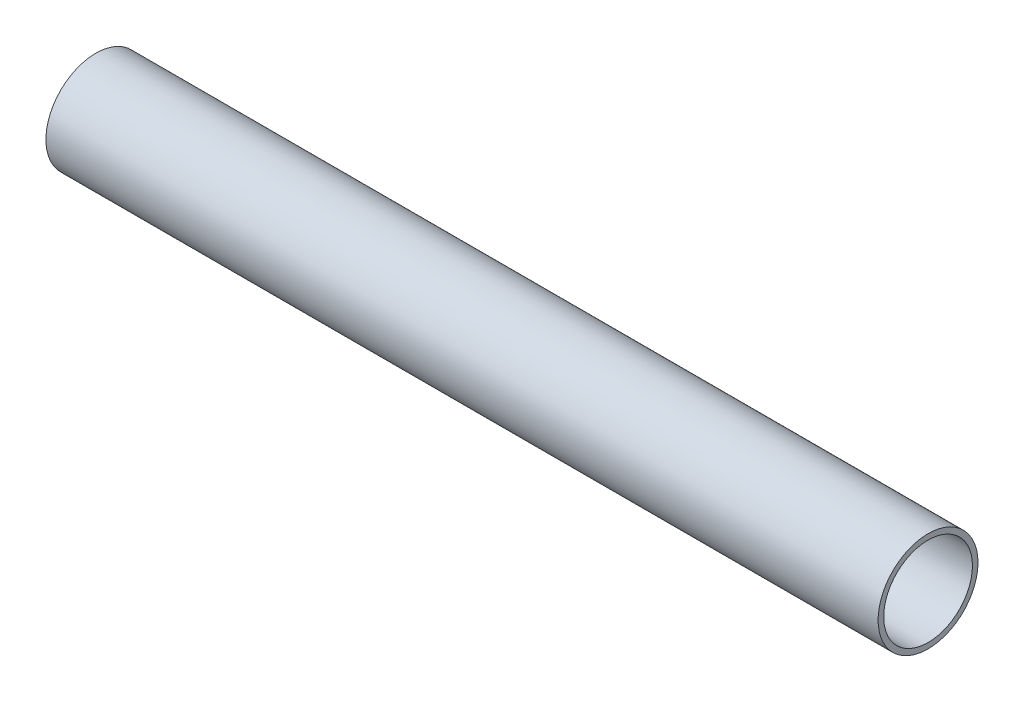
from build123d import *

# Parameters (mm, degrees)
SKIZZE1_R                       = 9
SKIZZE1_R_2                     = 8
AUFSATZ_LINEAR_AUSTRAGEN1_DEPTH = 150


with BuildPart() as part:
    # Skizze1 → Aufsatz-Linear austragen1 (new body)
    with BuildSketch(Plane(origin=(0, 0, 0), x_dir=(0, 0, -1), z_dir=(1, 0, 0))):
        Circle(SKIZZE1_R)
        Circle(SKIZZE1_R_2, mode=Mode.SUBTRACT)
    extrude(amount=AUFSATZ_LINEAR_AUSTRAGEN1_DEPTH)


solid = part.part
